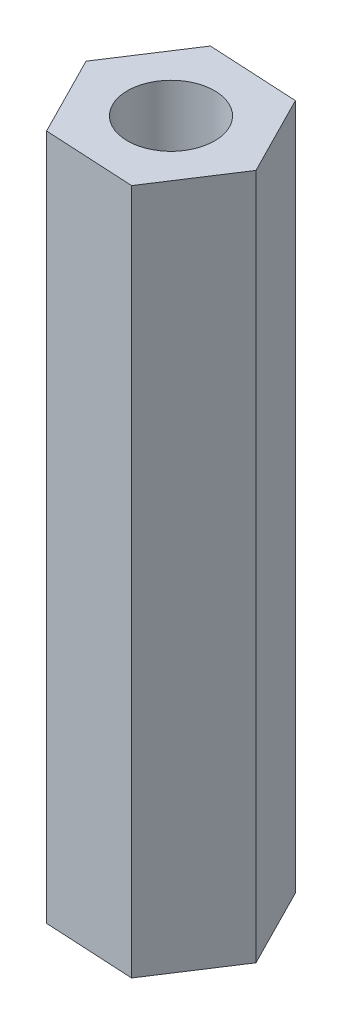
from build123d import *

# Parameters (mm, degrees)
EXTRUDE_1_DEPTH    = 26
HOLE_WIZARD_M4_1_D = 3.3


with BuildPart() as part:
    # 草图1 → 凸台-拉伸1 (new body)
    with BuildSketch(Plane(origin=(0, 0, 0), x_dir=(1, 0, 0), z_dir=(0, 1, 0))):
        Polygon((3.401504202, -0.181940922), (1.858317562, 2.854818589), (-1.54318664, 3.036759511), (-3.401504202, 0.181940922), (-1.858317562, -2.854818589), (1.54318664, -3.036759511), align=None)
    extrude(amount=EXTRUDE_1_DEPTH)

    # M4 螺纹孔1 (through all)
    with Locations(Plane(origin=(0, 26, 0), x_dir=(1, 0, 0), z_dir=(0, 1, 0))):
        with Locations((0, 0)):
            Hole(HOLE_WIZARD_M4_1_D / 2)


solid = part.part
